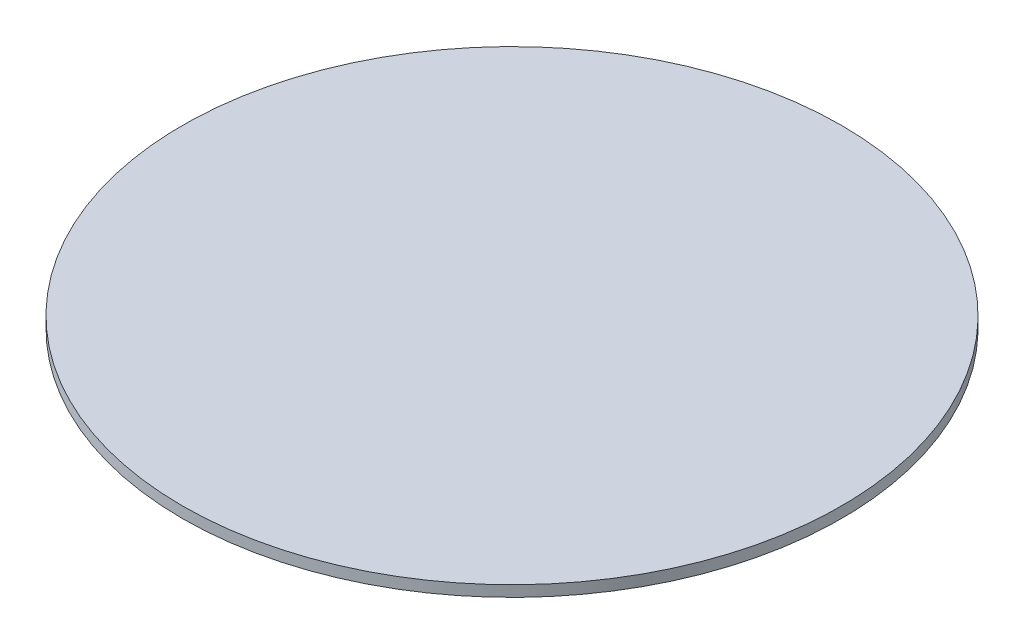
from build123d import *

# Parameters (mm, degrees)
SKETCH_1_R      = 30
EXTRUDE_1_DEPTH = 1


with BuildPart() as part:
    # 草图1 → 凸台-拉伸1 (new body)
    with BuildSketch(Plane(origin=(0, 0, 0), x_dir=(1, 0, 0), z_dir=(0, 1, 0))):
        with Locations(Location((0, 0, 0), (0, 0, 270))):
            Circle(SKETCH_1_R)
    extrude(amount=EXTRUDE_1_DEPTH)


solid = part.part
